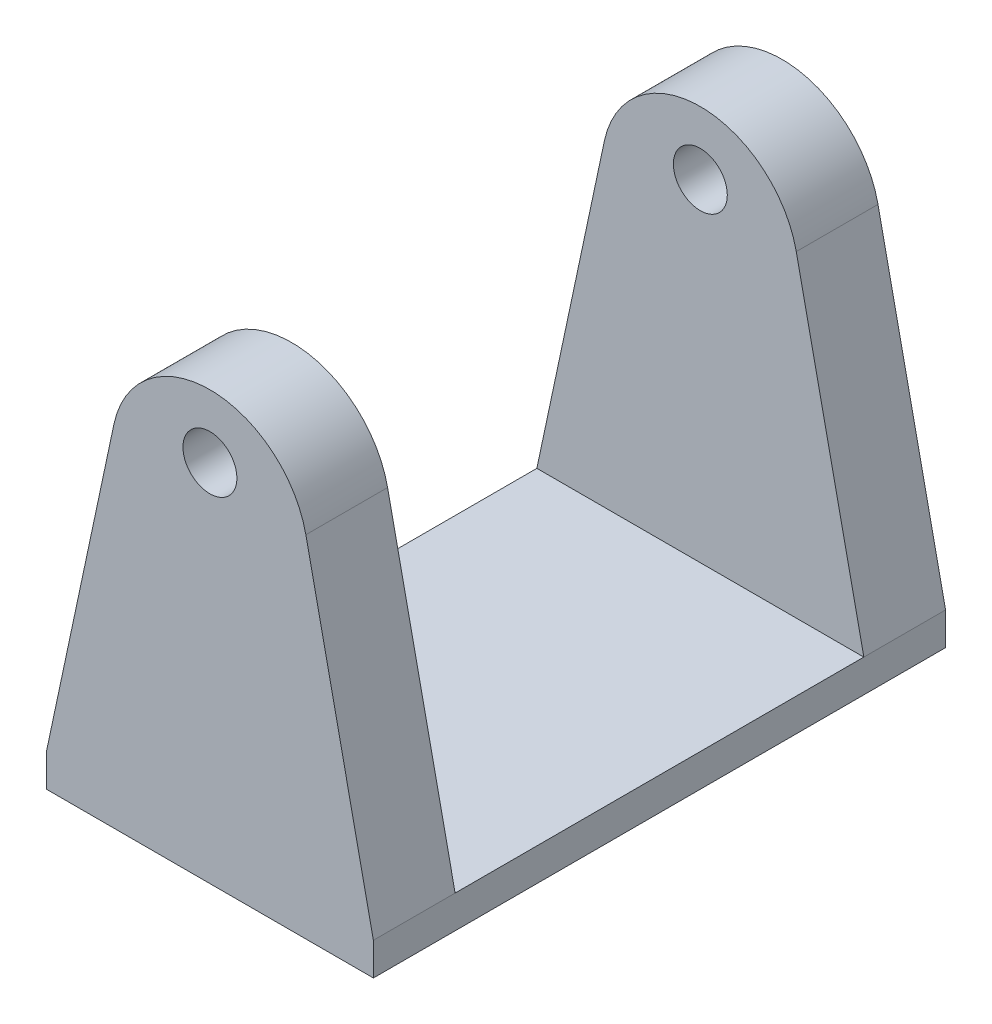
from build123d import *

# Parameters (mm, degrees)
SKETCH2_W                       = 20
SKETCH2_H                       = 35
BOSS_EXTRUDE2_DEPTH             = 2
BOSS_EXTRUDE5_DEPTH             = 5
BOSS_EXTRUDE6_DEPTH             = 5
FILLET1_R                       = 6
PREFORO_DA_MASCHIARE_M4_1_D     = 3.3
PREFORO_DA_MASCHIARE_M4_1_DEPTH = 5.000103078
PREFORO_DA_MASCHIARE_M4_2_D     = 3.3


with BuildPart() as part:
    # Sketch2 → Boss-Extrude2 (new body)
    with BuildSketch(Plane(origin=(0, 0, 0), x_dir=(1, 0, 0), z_dir=(0, 1, 0))):
        with Locations((10, 17.5)):
            Rectangle(SKETCH2_W, SKETCH2_H)
    extrude(amount=BOSS_EXTRUDE2_DEPTH)

    # 3DSketch3 → Boss-Extrude5 (add)
    with BuildSketch(Plane(origin=(10, 49, 0), x_dir=(-0.20810764446485872, -0.9781059289848355, 0), z_dir=(0, 0, 1))):
        Polygon((0, 0), (48.052055107, 0), (43.889902218, 19.56211858), align=None)
    extrude(amount=-BOSS_EXTRUDE5_DEPTH)

    # 3DSketch4 → Boss-Extrude6 (add)
    with BuildSketch(Plane(origin=(10, 2, -35), x_dir=(0, 1, 0), z_dir=(0, 0, 1))):
        Polygon((47, 0), (0, 10), (0, -10), align=None)
    extrude(amount=BOSS_EXTRUDE6_DEPTH)

    # Fillet1
    fillet1_edges = [part.edges().sort_by_distance(p)[0] for p in [
        (10, 49, -2.5),
        (10, 49, -32.5),
    ]]
    fillet(fillet1_edges, radius=FILLET1_R)

    # Preforo da maschiare M4-1
    with Locations(Plane.XY.offset(-30)):
        with Locations((10, 22.3)):
            Hole(PREFORO_DA_MASCHIARE_M4_1_D / 2, depth=PREFORO_DA_MASCHIARE_M4_1_DEPTH)

    # Preforo da maschiare M4-2 (through all)
    with Locations(Plane(origin=(0, 0, -5), x_dir=(-1, 0, 0), z_dir=(0, 0, -1))):
        with Locations((-10, 22.3)):
            Hole(PREFORO_DA_MASCHIARE_M4_2_D / 2)


solid = part.part
